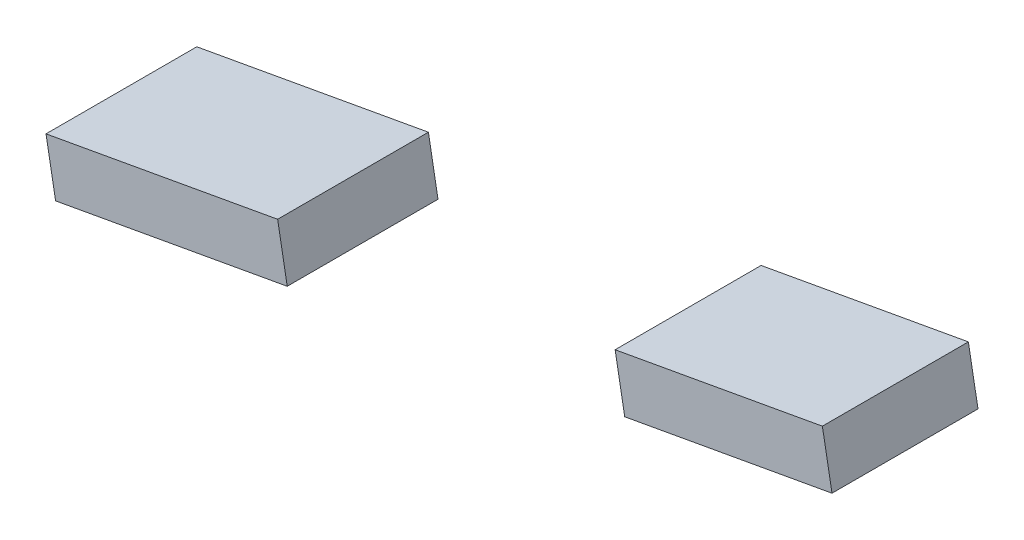
from build123d import *

# Parameters (mm, degrees)
SKETCH1_W             = 52.178759604
SKETCH1_H             = 33.429781577
BOSS_EXTRUDE1_DEPTH   = 12
SKETCH1_W_2           = 46.695567917
SKETCH1_H_2           = 32.368518669
BOSS_EXTRUDE1_2_DEPTH = 12


with BuildPart() as part:
    # Sketch1 → Boss-Extrude1 (new body)
    with BuildSketch(Plane(origin=(8, -44.283179651, 0), x_dir=(0.9840706589104218, 0.17777777777778753, 0), z_dir=(0.1777777777777875, -0.9840706589104217, 0))):
        with Locations((-62.992390369, 70.264914848)):
            Rectangle(SKETCH1_W, SKETCH1_H)
    extrude(amount=BOSS_EXTRUDE1_DEPTH)


with BuildPart() as body_2:
    # Sketch1 → Boss-Extrude1 2 (new body)
    with BuildSketch(Plane(origin=(8, -44.283179651, 0), x_dir=(0.9840706589104218, 0.17777777777778753, 0), z_dir=(0.1777777777777875, -0.9840706589104217, 0))):
        with Locations((63.916965617, 72.210563511)):
            Rectangle(SKETCH1_W_2, SKETCH1_H_2)
    extrude(amount=BOSS_EXTRUDE1_2_DEPTH)


solid = Compound([part.part, body_2.part])
